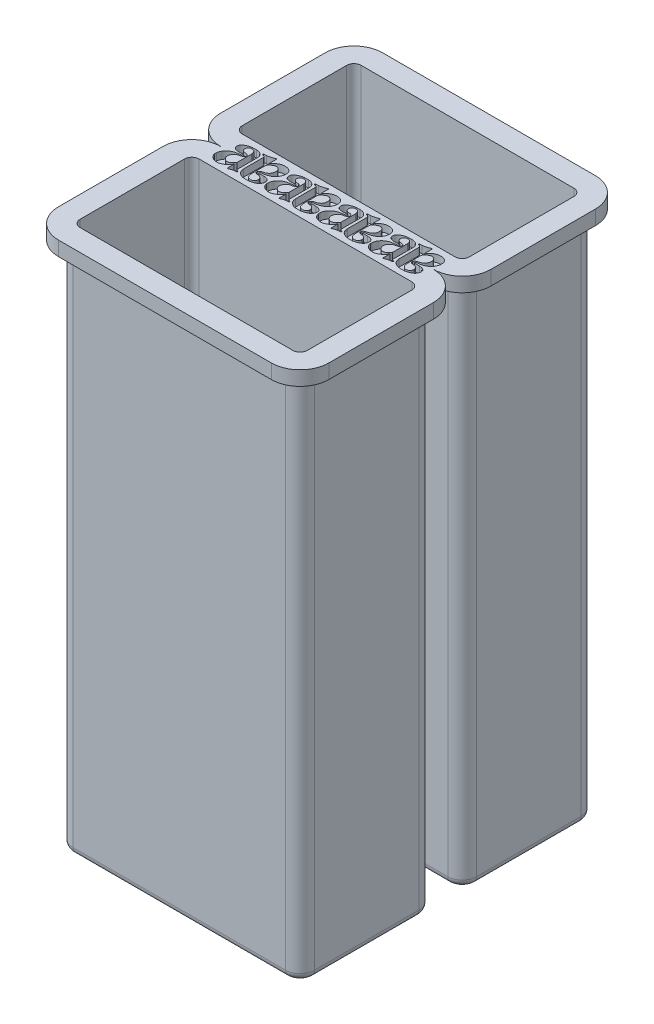
from build123d import *

# Parameters (mm, degrees)
SALIENTE_EXTRUIR1_DEPTH = 74
CROQUIS2_W              = 40
CROQUIS2_H              = 47
CORTAR_EXTRUIR1_DEPTH   = 72
SALIENTE_EXTRUIR2_START = 1
SALIENTE_EXTRUIR2_DEPTH = 1
REDONDEO1_R             = 1
CORTAR_EXTRUIR2_DEPTH   = 1


with BuildPart() as part:
    # Croquis1 → Saliente-Extruir1 (new body)
    with BuildSketch(Plane(origin=(0, 0, 0), x_dir=(1, 0, 0), z_dir=(0, 1, 0))):
        with BuildLine():
            Line((-18.765, 18.5), (-18.765, 4))
            ThreePointArc((-18.765, 4), (-17.593427125, 1.171572875), (-14.765, 0))
            ThreePointArc((-14.765, 0), (-17.593427125, -1.171572875), (-18.765, -4))
            Line((-18.765, -4), (-18.765, -18.5))
            ThreePointArc((-18.765, -18.5), (-17.593427125, -21.328427125), (-14.765, -22.5))
            Line((-14.765, -22.5), (14.765, -22.5))
            ThreePointArc((14.765, -22.5), (17.593427125, -21.328427125), (18.765, -18.5))
            Line((18.765, -18.5), (18.765, -4))
            ThreePointArc((18.765, -4), (17.593427125, -1.171572875), (14.765, 0))
            ThreePointArc((14.765, 0), (17.593427125, 1.171572875), (18.765, 4))
            Line((18.765, 4), (18.765, 18.5))
            ThreePointArc((18.765, 18.5), (17.593427125, 21.328427125), (14.765, 22.5))
            Line((14.765, 22.5), (-14.765, 22.5))
            ThreePointArc((-14.765, 22.5), (-17.593427125, 21.328427125), (-18.765, 18.5))
        make_face()
        with BuildLine():
            Line((-14.765, -3), (14.765, -3))
            ThreePointArc((14.765, -3), (15.472106781, -3.292893219), (15.765, -4))
            Line((15.765, -4), (15.765, -18.5))
            ThreePointArc((15.765, -18.5), (15.472106781, -19.207106781), (14.765, -19.5))
            Line((14.765, -19.5), (-14.765, -19.5))
            ThreePointArc((-14.765, -19.5), (-15.472106781, -19.207106781), (-15.765, -18.5))
            Line((-15.765, -18.5), (-15.765, -4))
            ThreePointArc((-15.765, -4), (-15.472106781, -3.292893219), (-14.765, -3))
        make_face(mode=Mode.SUBTRACT)
        with BuildLine():
            Line((-14.765, 19.5), (14.765, 19.5))
            ThreePointArc((14.765, 19.5), (15.472106781, 19.207106781), (15.765, 18.5))
            Line((15.765, 18.5), (15.765, 4))
            ThreePointArc((15.765, 4), (15.472106781, 3.292893219), (14.765, 3))
            Line((14.765, 3), (-14.765, 3))
            ThreePointArc((-14.765, 3), (-15.472106781, 3.292893219), (-15.765, 4))
            Line((-15.765, 4), (-15.765, 18.5))
            ThreePointArc((-15.765, 18.5), (-15.472106781, 19.207106781), (-14.765, 19.5))
        make_face(mode=Mode.SUBTRACT)
    extrude(amount=-SALIENTE_EXTRUIR1_DEPTH)

    # Croquis2 → Cortar-Extruir1 (cut)
    with BuildSketch(Plane.XZ.offset(74)):
        Rectangle(CROQUIS2_W, CROQUIS2_H)
        with BuildLine():
            Line((-14.765, 2), (14.765, 2))
            ThreePointArc((14.765, 2), (16.179213562, 2.585786438), (16.765, 4))
            Line((16.765, 4), (16.765, 18.5))
            ThreePointArc((16.765, 18.5), (16.179213562, 19.914213562), (14.765, 20.5))
            Line((14.765, 20.5), (-14.765, 20.5))
            ThreePointArc((-14.765, 20.5), (-16.179213562, 19.914213562), (-16.765, 18.5))
            Line((-16.765, 18.5), (-16.765, 4))
            ThreePointArc((-16.765, 4), (-16.179213562, 2.585786438), (-14.765, 2))
        make_face(mode=Mode.SUBTRACT)
        with BuildLine():
            Line((14.765, -20.5), (-14.765, -20.5))
            ThreePointArc((-14.765, -20.5), (-16.179213562, -19.914213562), (-16.765, -18.5))
            Line((-16.765, -18.5), (-16.765, -4))
            ThreePointArc((-16.765, -4), (-16.179213562, -2.585786438), (-14.765, -2))
            Line((-14.765, -2), (14.765, -2))
            ThreePointArc((14.765, -2), (16.179213562, -2.585786438), (16.765, -4))
            Line((16.765, -4), (16.765, -18.5))
            ThreePointArc((16.765, -18.5), (16.179213562, -19.914213562), (14.765, -20.5))
        make_face(mode=Mode.SUBTRACT)
    extrude(amount=-CORTAR_EXTRUIR1_DEPTH, mode=Mode.SUBTRACT)

    # Croquis3 → Saliente-Extruir2 (add)
    with BuildSketch(Plane.XZ.offset(74).offset(SALIENTE_EXTRUIR2_START)):
        with BuildLine():
            Line((-14.765, 2), (14.765, 2))
            ThreePointArc((14.765, 2), (16.179213562, 2.585786438), (16.765, 4))
            Line((16.765, 4), (16.765, 18.5))
            ThreePointArc((16.765, 18.5), (16.179213562, 19.914213562), (14.765, 20.5))
            Line((14.765, 20.5), (-14.765, 20.5))
            ThreePointArc((-14.765, 20.5), (-16.179213562, 19.914213562), (-16.765, 18.5))
            Line((-16.765, 18.5), (-16.765, 4))
            ThreePointArc((-16.765, 4), (-16.179213562, 2.585786438), (-14.765, 2))
        make_face()
        with BuildLine():
            Line((-14.765, -20.5), (14.765, -20.5))
            ThreePointArc((14.765, -20.5), (16.179213562, -19.914213562), (16.765, -18.5))
            Line((16.765, -18.5), (16.765, -4))
            ThreePointArc((16.765, -4), (16.179213562, -2.585786438), (14.765, -2))
            Line((14.765, -2), (-14.765, -2))
            ThreePointArc((-14.765, -2), (-16.179213562, -2.585786438), (-16.765, -4))
            Line((-16.765, -4), (-16.765, -18.5))
            ThreePointArc((-16.765, -18.5), (-16.179213562, -19.914213562), (-14.765, -20.5))
        make_face()
    extrude(amount=-SALIENTE_EXTRUIR2_DEPTH)

    # Redondeo1
    redondeo1_edges = [part.edges().sort_by_distance(p)[0] for p in [
        (-16.179213562, -75, 2.585786438),
        (0, -75, 2),
        (16.179213562, -75, 2.585786438),
        (16.765, -75, 11.25),
        (16.179213562, -75, 19.914213562),
        (0, -75, 20.5),
        (-16.179213562, -75, 19.914213562),
        (-16.765, -75, 11.25),
        (-16.179213562, -75, -19.914213562),
        (0, -75, -20.5),
        (16.179213562, -75, -19.914213562),
        (16.765, -75, -11.25),
        (16.179213562, -75, -2.585786438),
        (0, -75, -2),
        (-16.179213562, -75, -2.585786438),
        (-16.765, -75, -11.25),
        (-15.472106781, -74, -3.292893219),
        (-15.765, -74, -11.25),
        (-15.472106781, -74, -19.207106781),
        (0, -74, -19.5),
        (15.472106781, -74, -19.207106781),
        (15.765, -74, -11.25),
        (15.472106781, -74, -3.292893219),
        (0, -74, -3),
        (-15.472106781, -74, 3.292893219),
        (0, -74, 3),
        (15.472106781, -74, 3.292893219),
        (15.765, -74, 11.25),
        (15.472106781, -74, 19.207106781),
        (0, -74, 19.5),
        (-15.472106781, -74, 19.207106781),
        (-15.765, -74, 11.25),
    ]]
    fillet(redondeo1_edges, radius=REDONDEO1_R)

    # Croquis5 → Cortar-Extruir2 (cut)
    # profile 1 of 8: a face of its own
    with BuildSketch(Plane(origin=(0, 0, 0), x_dir=(1, 0, 0), z_dir=(0, 1, 0))):
        with BuildLine():
            Line((11.12208389, 1.643912915), (11.12208389, -1.094958944))
            add(Edge.make_bspline(
                [(11.12208389, -1.094958944), (11.143103596, -1.367116971), (11.26675666, -1.790244155), (11.78550182, -2.075329476), (12.055663212, -2.188627164), (12.270025204, -2.20343332)],
                knots=[0, 0, 0, 0, 0.49028352, 0.64538248, 1, 1, 1, 1], degree=3))
            Line((12.270025204, -2.20343332), (12.931693569, -2.20343332))
            add(Edge.make_bspline(
                [(12.931693569, -2.20343332), (13.267455898, -2.132026233), (13.860111992, -1.992222085), (14.208009012, -1.470453413), (14.227846028, -1.250333744)],
                knots=[0, 0, 0, 0, 0.615534464, 1, 1, 1, 1], degree=3))
            Line((14.227846028, -1.250333744), (14.227846028, -1.075128784))
            add(Edge.make_bspline(
                [(14.227846028, -1.075128784), (14.215760622, -0.914032073), (14.048303878, -0.708530113), (13.718340934, -0.597297378), (13.520743991, -0.568548486), (13.422918181, -0.568548486)],
                knots=[0, 0, 0, 0, 0.437103845, 0.707413934, 1, 1, 1, 1], degree=3))
            Line((13.422918181, -0.568548486), (12.722501168, -0.568548486))
            add(Edge.make_bspline(
                [(12.722501168, -0.568548486), (12.677219764, -0.554150486), (12.659877431, -0.469737716), (12.72673467, -0.414149832), (12.809206676, -0.376136686), (12.928908015, -0.35756955), (13.743412231, -0.249738336), (14.503894256, 0.06106073), (14.699165118, 1.029991391)],
                knots=[0, 0, 0, 0, 0.049331567, 0.062709189, 0.093395869, 0.148478193, 0.194890473, 1, 1, 1, 1], degree=3))
            Line((14.699165118, 1.029991391), (14.699165118, 1.297045074))
            add(Edge.make_bspline(
                [(14.699165118, 1.297045074), (14.667228995, 1.896154917), (13.974671223, 2.183784884), (12.945133002, 2.00490288), (12.491163648, 1.603623606), (12.253690233, 1.297045074)],
                knots=[0, 0, 0, 0, 0.456887755, 0.617100867, 1, 1, 1, 1], degree=3))
            Line((12.253690233, 1.297045074), (12.253690233, 2.321369871))
            ThreePointArc((12.253690233, 2.321369871), (12.211693307, 2.383353665), (12.136828093, 2.384319181))
            add(Edge.make_bspline(
                [(12.136828093, 2.384319181), (11.656311094, 2.14125638), (11.12208389, 2.090223481)],
                knots=[0, 0, 0, 1, 1, 1], degree=2))
            Line((11.12208389, 2.090223481), (10.743662918, 2.064735118))
            add(Edge.make_bspline(
                [(10.743662918, 2.064735118), (10.691084323, 2.026068737), (10.707332751, 1.92982704), (10.79671894, 1.881008219), (10.894741199, 1.889913825), (11.041965363, 1.832129867), (11.129004731, 1.729214334), (11.12208389, 1.643912915)],
                knots=[0, 0, 0, 0, 0.243545996, 0.329014823, 0.43056247, 0.670310358, 1, 1, 1, 1], degree=3))
        make_face()
        with BuildLine():
            Line((13.440812647, -1.447476629), (13.440812647, -1.361386944))
            add(Edge.make_bspline(
                [(13.440812647, -1.361386944), (13.428435587, -1.232612056), (13.318111823, -0.956493715), (13.038908114, -0.843331196), (12.897247391, -0.828866168)],
                knots=[0, 0, 0, 0, 0.474595012, 1, 1, 1, 1], degree=3))
            Line((12.897247391, -0.828866168), (12.633859698, -0.801971556))
            add(Edge.make_bspline(
                [(12.633859698, -0.801971556), (12.543347909, -0.803095879), (12.442992721, -0.72502402), (12.383855878, -0.607760687), (12.383855878, -0.568548486)],
                knots=[0, 0, 0, 0, 0.677295293, 1, 1, 1, 1], degree=3))
            Line((12.383855878, -0.568548486), (12.383855878, -0.491929702))
            add(Edge.make_bspline(
                [(12.383855878, -0.491929702), (12.424240549, -0.361581816), (12.610074367, -0.186002693), (12.960305701, -0.135556169), (13.246110712, -0.003859871), (13.529723206, 0.197934137), (13.69174869, 0.577243687), (13.706456953, 0.945190105), (13.594842897, 1.209746296), (13.470888479, 1.346678302), (13.326567673, 1.436209483), (13.218647786, 1.456668455), (13.183549965, 1.456668455)],
                knots=[0, 0, 0, 0, 0.139662031, 0.240587309, 0.361900049, 0.46450752, 0.592990267, 0.77477529, 0.82920301, 0.886761562, 0.964190872, 1, 1, 1, 1], degree=3))
            Line((13.183549965, 1.456668455), (13.09195894, 1.456668455))
            add(Edge.make_bspline(
                [(13.09195894, 1.456668455), (12.968933412, 1.456668455), (12.621408692, 1.304940049), (12.350003508, 1.059195498), (12.246380721, 0.8335108)],
                knots=[0, 0, 0, 0, 0.336652232, 1, 1, 1, 1], degree=3))
            Line((12.246380721, 0.8335108), (12.246380721, -1.085921855))
            add(Edge.make_bspline(
                [(12.246380721, -1.085921855), (12.257895123, -1.291480753), (12.311907368, -1.751970024), (13.033071176, -2.054587117), (13.425853132, -1.693891745), (13.440812647, -1.447476629)],
                knots=[0, 0, 0, 0, 0.334105821, 0.635982622, 1, 1, 1, 1], degree=3))
        make_face(mode=Mode.SUBTRACT)
    # profile 2 of 8: a face of its own
    with BuildSketch(Plane(origin=(0, 0, 0), x_dir=(1, 0, 0), z_dir=(0, 1, 0))):
        with BuildLine():
            Line((10.743662918, -1.603485438), (10.743662918, 1.315881708))
            add(Edge.make_bspline(
                [(10.743662918, 1.315881708), (10.743662918, 1.411272589), (10.674162753, 1.593366901), (10.489518185, 1.833638633), (10.237728335, 1.994131484), (9.969487206, 2.070284385), (9.80255614, 2.092020614), (9.720539747, 2.090223481)],
                knots=[0, 0, 0, 0, 0.199723375, 0.404213542, 0.642940483, 0.823735254, 1, 1, 1, 1], degree=3))
            Line((9.720539747, 2.090223481), (9.211659339, 2.079072954))
            add(Edge.make_bspline(
                [(9.211659339, 2.079072954), (8.871703706, 2.045747326), (8.415923943, 1.897197905), (7.866853558, 1.430222064), (7.922776323, 0.939190479), (8.167342512, 0.709957463), (8.282084493, 0.668166078), (8.377744449, 0.655896726)],
                knots=[0, 0, 0, 0, 0.418753771, 0.587264904, 0.852530768, 0.886586146, 1, 1, 1, 1], degree=3))
            add(Edge.make_bspline(
                [(8.377744449, 0.655896726), (8.601833281, 0.608996898), (8.902677601, 0.594928677), (9.239066528, 0.644033194), (9.371376406, 0.651295128), (9.456857568, 0.647229026), (9.501126743, 0.60286417), (9.507827575, 0.54093702), (9.442292491, 0.481794181), (9.330623304, 0.433552855), (9.168560647, 0.407140203), (8.96500607, 0.383602339), (8.741493989, 0.331582466), (8.494071445, 0.2894075), (8.013529857, 0.115787534), (7.483172175, -0.323440276), (7.31385593, -0.867242242), (7.30836678, -1.075128784)],
                knots=[0, 0, 0, 0, 0.164670443, 0.215991005, 0.244354815, 0.261612246, 0.275207239, 0.285848572, 0.302822203, 0.332909342, 0.374903834, 0.420011135, 0.481324638, 0.540460624, 0.600937118, 0.850065081, 1, 1, 1, 1], degree=3))
            Line((7.30836678, -1.075128784), (7.299165118, -1.295892736))
            add(Edge.make_bspline(
                [(7.299165118, -1.295892736), (7.332630694, -1.493232783), (7.526316457, -1.871000112), (8.056916905, -2.124546468), (8.982832462, -2.197839555), (9.632852928, -1.646333936), (9.894799414, -1.18551076)],
                knots=[0, 0, 0, 0, 0.180676094, 0.357502802, 0.502936532, 1, 1, 1, 1], degree=3))
            Line((9.894799414, -1.18551076), (9.894799414, -2.100138227))
            ThreePointArc((9.894799414, -2.100138227), (9.917251527, -2.154342423), (9.971455724, -2.176794537))
            ThreePointArc((9.971455724, -2.176794537), (10.010331723, -2.171059348), (10.04589547, -2.154342423))
            add(Edge.make_bspline(
                [(10.04589547, -2.154342423), (10.196764264, -2.087088256), (10.507723746, -1.942674921), (10.850063116, -1.942658883), (11.015511882, -1.920239014)],
                knots=[0, 0, 0, 0, 0.49789426, 1, 1, 1, 1], degree=3))
            ThreePointArc((11.015511882, -1.920239014), (11.047811324, -1.904255378), (11.063861858, -1.871989127))
            Line((11.063861858, -1.871989127), (11.063861858, -1.815197949))
            ThreePointArc((11.063861858, -1.815197949), (11.049213205, -1.783374475), (11.015511882, -1.773806963))
            add(Edge.make_bspline(
                [(11.015511882, -1.773806963), (10.951499944, -1.773768428), (10.836242326, -1.738176687), (10.766208378, -1.645293694), (10.743662918, -1.603485438)],
                knots=[0, 0, 0, 0, 0.574061575, 1, 1, 1, 1], degree=3))
        make_face()
        with BuildLine():
            Line((9.894799414, -0.771214892), (9.894799414, 1.315881708))
            add(Edge.make_bspline(
                [(9.894799414, 1.315881708), (9.85107007, 1.45785879), (9.790549356, 1.721307641), (9.405057197, 1.934476978), (8.941860894, 1.847627845), (8.749309721, 1.423926851), (8.872620936, 1.060492519), (9.192539027, 0.921289593), (9.462293896, 0.942997448), (9.669206009, 0.862923182), (9.830639939, 0.691013729), (9.78089647, 0.420543303), (9.595373309, 0.32992916), (9.442320402, 0.277504306), (9.241031613, 0.212716427), (9.016287602, 0.187157961), (8.780072001, 0.02925763), (8.492736735, -0.258257038), (8.315453133, -0.942962776), (9.192851436, -1.660586204), (9.752627217, -1.010422622), (9.894799414, -0.771214892)],
                knots=[0, 0, 0, 0, 0.066892963, 0.099946621, 0.178793471, 0.231586427, 0.27714866, 0.325592682, 0.36601227, 0.390454899, 0.416998256, 0.460092448, 0.480657107, 0.501537674, 0.528892465, 0.569983398, 0.594816366, 0.647097793, 0.741154623, 0.856429425, 1, 1, 1, 1], degree=3))
        make_face(mode=Mode.SUBTRACT)
    # profile 3 of 8: a face of its own
    with BuildSketch(Plane(origin=(0, 0, 0), x_dir=(1, 0, 0), z_dir=(0, 1, 0))):
        with BuildLine():
            Line((3.92208389, 1.643912915), (3.92208389, -1.094958944))
            add(Edge.make_bspline(
                [(3.92208389, -1.094958944), (3.943103596, -1.367116971), (4.06675666, -1.790244155), (4.58550182, -2.075329476), (4.855663212, -2.188627164), (5.070025204, -2.20343332)],
                knots=[0, 0, 0, 0, 0.49028352, 0.64538248, 1, 1, 1, 1], degree=3))
            Line((5.070025204, -2.20343332), (5.731693569, -2.20343332))
            add(Edge.make_bspline(
                [(5.731693569, -2.20343332), (6.067455898, -2.132026233), (6.660111992, -1.992222085), (7.008009012, -1.470453413), (7.027846028, -1.250333744)],
                knots=[0, 0, 0, 0, 0.615534464, 1, 1, 1, 1], degree=3))
            Line((7.027846028, -1.250333744), (7.027846028, -1.075128784))
            add(Edge.make_bspline(
                [(7.027846028, -1.075128784), (7.015760622, -0.914032073), (6.848303878, -0.708530113), (6.518340934, -0.597297378), (6.320743991, -0.568548486), (6.222918181, -0.568548486)],
                knots=[0, 0, 0, 0, 0.437103845, 0.707413934, 1, 1, 1, 1], degree=3))
            Line((6.222918181, -0.568548486), (5.522501168, -0.568548486))
            add(Edge.make_bspline(
                [(5.522501168, -0.568548486), (5.477219764, -0.554150486), (5.459877431, -0.469737716), (5.52673467, -0.414149832), (5.609206676, -0.376136686), (5.728908015, -0.35756955), (6.543412231, -0.249738336), (7.303894256, 0.06106073), (7.499165118, 1.029991391)],
                knots=[0, 0, 0, 0, 0.049331567, 0.062709189, 0.093395869, 0.148478193, 0.194890473, 1, 1, 1, 1], degree=3))
            Line((7.499165118, 1.029991391), (7.499165118, 1.297045074))
            add(Edge.make_bspline(
                [(7.499165118, 1.297045074), (7.467228995, 1.896154917), (6.774671223, 2.183784884), (5.745133002, 2.00490288), (5.291163648, 1.603623606), (5.053690233, 1.297045074)],
                knots=[0, 0, 0, 0, 0.456887755, 0.617100867, 1, 1, 1, 1], degree=3))
            Line((5.053690233, 1.297045074), (5.053690233, 2.321369871))
            ThreePointArc((5.053690233, 2.321369871), (5.011693307, 2.383353665), (4.936828093, 2.384319181))
            add(Edge.make_bspline(
                [(4.936828093, 2.384319181), (4.456311094, 2.14125638), (3.92208389, 2.090223481)],
                knots=[0, 0, 0, 1, 1, 1], degree=2))
            Line((3.92208389, 2.090223481), (3.543662918, 2.064735118))
            add(Edge.make_bspline(
                [(3.543662918, 2.064735118), (3.491084323, 2.026068737), (3.507332751, 1.92982704), (3.59671894, 1.881008219), (3.694741199, 1.889913825), (3.841965363, 1.832129867), (3.929004731, 1.729214334), (3.92208389, 1.643912915)],
                knots=[0, 0, 0, 0, 0.243545996, 0.329014823, 0.43056247, 0.670310358, 1, 1, 1, 1], degree=3))
        make_face()
        with BuildLine():
            Line((6.240812647, -1.447476629), (6.240812647, -1.361386944))
            add(Edge.make_bspline(
                [(6.240812647, -1.361386944), (6.228435587, -1.232612056), (6.118111823, -0.956493715), (5.838908114, -0.843331196), (5.697247391, -0.828866168)],
                knots=[0, 0, 0, 0, 0.474595012, 1, 1, 1, 1], degree=3))
            Line((5.697247391, -0.828866168), (5.433859698, -0.801971556))
            add(Edge.make_bspline(
                [(5.433859698, -0.801971556), (5.343347909, -0.803095879), (5.242992721, -0.72502402), (5.183855878, -0.607760687), (5.183855878, -0.568548486)],
                knots=[0, 0, 0, 0, 0.677295293, 1, 1, 1, 1], degree=3))
            Line((5.183855878, -0.568548486), (5.183855878, -0.491929702))
            add(Edge.make_bspline(
                [(5.183855878, -0.491929702), (5.224240549, -0.361581816), (5.410074367, -0.186002693), (5.760305701, -0.135556169), (6.046110712, -0.003859871), (6.329723206, 0.197934137), (6.49174869, 0.577243687), (6.506456953, 0.945190105), (6.394842897, 1.209746296), (6.270888479, 1.346678302), (6.126567673, 1.436209483), (6.018647786, 1.456668455), (5.983549965, 1.456668455)],
                knots=[0, 0, 0, 0, 0.139662031, 0.240587309, 0.361900049, 0.46450752, 0.592990267, 0.77477529, 0.82920301, 0.886761562, 0.964190872, 1, 1, 1, 1], degree=3))
            Line((5.983549965, 1.456668455), (5.89195894, 1.456668455))
            add(Edge.make_bspline(
                [(5.89195894, 1.456668455), (5.768933412, 1.456668455), (5.421408692, 1.304940049), (5.150003508, 1.059195498), (5.046380721, 0.8335108)],
                knots=[0, 0, 0, 0, 0.336652232, 1, 1, 1, 1], degree=3))
            Line((5.046380721, 0.8335108), (5.046380721, -1.085921855))
            add(Edge.make_bspline(
                [(5.046380721, -1.085921855), (5.057895123, -1.291480753), (5.111907368, -1.751970024), (5.833071176, -2.054587117), (6.225853132, -1.693891745), (6.240812647, -1.447476629)],
                knots=[0, 0, 0, 0, 0.334105821, 0.635982622, 1, 1, 1, 1], degree=3))
        make_face(mode=Mode.SUBTRACT)
    # profile 4 of 8: a face of its own
    with BuildSketch(Plane(origin=(0, 0, 0), x_dir=(1, 0, 0), z_dir=(0, 1, 0))):
        with BuildLine():
            Line((3.543662918, -1.603485438), (3.543662918, 1.315881708))
            add(Edge.make_bspline(
                [(3.543662918, 1.315881708), (3.543662918, 1.411272589), (3.474162753, 1.593366901), (3.289518185, 1.833638633), (3.037728335, 1.994131484), (2.769487206, 2.070284385), (2.60255614, 2.092020614), (2.520539747, 2.090223481)],
                knots=[0, 0, 0, 0, 0.199723375, 0.404213542, 0.642940483, 0.823735254, 1, 1, 1, 1], degree=3))
            Line((2.520539747, 2.090223481), (2.011659339, 2.079072954))
            add(Edge.make_bspline(
                [(2.011659339, 2.079072954), (1.671703706, 2.045747326), (1.215923943, 1.897197905), (0.666853558, 1.430222064), (0.722776323, 0.939190479), (0.967342512, 0.709957463), (1.082084493, 0.668166078), (1.177744449, 0.655896726)],
                knots=[0, 0, 0, 0, 0.418753771, 0.587264904, 0.852530768, 0.886586146, 1, 1, 1, 1], degree=3))
            add(Edge.make_bspline(
                [(1.177744449, 0.655896726), (1.401833281, 0.608996898), (1.702677601, 0.594928677), (2.039066528, 0.644033194), (2.171376406, 0.651295128), (2.256857568, 0.647229026), (2.301126743, 0.60286417), (2.307827575, 0.54093702), (2.242292491, 0.481794181), (2.130623304, 0.433552855), (1.968560647, 0.407140203), (1.76500607, 0.383602339), (1.541493989, 0.331582466), (1.294071445, 0.2894075), (0.813529857, 0.115787534), (0.283172175, -0.323440276), (0.11385593, -0.867242242), (0.10836678, -1.075128784)],
                knots=[0, 0, 0, 0, 0.164670443, 0.215991005, 0.244354815, 0.261612246, 0.275207239, 0.285848572, 0.302822203, 0.332909342, 0.374903834, 0.420011135, 0.481324638, 0.540460624, 0.600937118, 0.850065081, 1, 1, 1, 1], degree=3))
            Line((0.10836678, -1.075128784), (0.099165118, -1.295892736))
            add(Edge.make_bspline(
                [(0.099165118, -1.295892736), (0.132630694, -1.493232783), (0.326316457, -1.871000112), (0.856916905, -2.124546468), (1.782832462, -2.197839555), (2.432852928, -1.646333936), (2.694799414, -1.18551076)],
                knots=[0, 0, 0, 0, 0.180676094, 0.357502802, 0.502936532, 1, 1, 1, 1], degree=3))
            Line((2.694799414, -1.18551076), (2.694799414, -2.100138227))
            ThreePointArc((2.694799414, -2.100138227), (2.717251527, -2.154342423), (2.771455724, -2.176794537))
            ThreePointArc((2.771455724, -2.176794537), (2.810331723, -2.171059348), (2.84589547, -2.154342423))
            add(Edge.make_bspline(
                [(2.84589547, -2.154342423), (2.996764264, -2.087088256), (3.307723746, -1.942674921), (3.650063116, -1.942658883), (3.815511882, -1.920239014)],
                knots=[0, 0, 0, 0, 0.49789426, 1, 1, 1, 1], degree=3))
            ThreePointArc((3.815511882, -1.920239014), (3.847811324, -1.904255378), (3.863861858, -1.871989127))
            Line((3.863861858, -1.871989127), (3.863861858, -1.815197949))
            ThreePointArc((3.863861858, -1.815197949), (3.849213205, -1.783374475), (3.815511882, -1.773806963))
            add(Edge.make_bspline(
                [(3.815511882, -1.773806963), (3.751499944, -1.773768428), (3.636242326, -1.738176687), (3.566208378, -1.645293694), (3.543662918, -1.603485438)],
                knots=[0, 0, 0, 0, 0.574061575, 1, 1, 1, 1], degree=3))
        make_face()
        with BuildLine():
            Line((2.694799414, -0.771214892), (2.694799414, 1.315881708))
            add(Edge.make_bspline(
                [(2.694799414, 1.315881708), (2.65107007, 1.45785879), (2.590549356, 1.721307641), (2.205057197, 1.934476978), (1.741860894, 1.847627845), (1.549309721, 1.423926851), (1.672620936, 1.060492519), (1.992539027, 0.921289593), (2.262293896, 0.942997448), (2.469206009, 0.862923182), (2.630639939, 0.691013729), (2.58089647, 0.420543303), (2.395373309, 0.32992916), (2.242320402, 0.277504306), (2.041031613, 0.212716427), (1.816287602, 0.187157961), (1.580072001, 0.02925763), (1.292736735, -0.258257038), (1.115453133, -0.942962776), (1.992851436, -1.660586204), (2.552627217, -1.010422622), (2.694799414, -0.771214892)],
                knots=[0, 0, 0, 0, 0.066892963, 0.099946621, 0.178793471, 0.231586427, 0.27714866, 0.325592682, 0.36601227, 0.390454899, 0.416998256, 0.460092448, 0.480657107, 0.501537674, 0.528892465, 0.569983398, 0.594816366, 0.647097793, 0.741154623, 0.856429425, 1, 1, 1, 1], degree=3))
        make_face(mode=Mode.SUBTRACT)
    # profile 5 of 8: a face of its own
    with BuildSketch(Plane(origin=(0, 0, 0), x_dir=(1, 0, 0), z_dir=(0, 1, 0))):
        with BuildLine():
            Line((-3.27791611, 1.643912915), (-3.27791611, -1.094958944))
            add(Edge.make_bspline(
                [(-3.27791611, -1.094958944), (-3.256896404, -1.367116971), (-3.13324334, -1.790244155), (-2.61449818, -2.075329476), (-2.344336788, -2.188627164), (-2.129974796, -2.20343332)],
                knots=[0, 0, 0, 0, 0.49028352, 0.64538248, 1, 1, 1, 1], degree=3))
            Line((-2.129974796, -2.20343332), (-1.468306431, -2.20343332))
            add(Edge.make_bspline(
                [(-1.468306431, -2.20343332), (-1.132544102, -2.132026233), (-0.539888008, -1.992222085), (-0.191990988, -1.470453413), (-0.172153972, -1.250333744)],
                knots=[0, 0, 0, 0, 0.615534464, 1, 1, 1, 1], degree=3))
            Line((-0.172153972, -1.250333744), (-0.172153972, -1.075128784))
            add(Edge.make_bspline(
                [(-0.172153972, -1.075128784), (-0.184239378, -0.914032073), (-0.351696122, -0.708530113), (-0.681659066, -0.597297378), (-0.879256009, -0.568548486), (-0.977081819, -0.568548486)],
                knots=[0, 0, 0, 0, 0.437103845, 0.707413934, 1, 1, 1, 1], degree=3))
            Line((-0.977081819, -0.568548486), (-1.677498832, -0.568548486))
            add(Edge.make_bspline(
                [(-1.677498832, -0.568548486), (-1.722780236, -0.554150486), (-1.740122569, -0.469737716), (-1.67326533, -0.414149832), (-1.590793324, -0.376136686), (-1.471091985, -0.35756955), (-0.656587769, -0.249738336), (0.103894256, 0.06106073), (0.299165118, 1.029991391)],
                knots=[0, 0, 0, 0, 0.049331567, 0.062709189, 0.093395869, 0.148478193, 0.194890473, 1, 1, 1, 1], degree=3))
            Line((0.299165118, 1.029991391), (0.299165118, 1.297045074))
            add(Edge.make_bspline(
                [(0.299165118, 1.297045074), (0.267228995, 1.896154917), (-0.425328777, 2.183784884), (-1.454866998, 2.00490288), (-1.908836352, 1.603623606), (-2.146309767, 1.297045074)],
                knots=[0, 0, 0, 0, 0.456887755, 0.617100867, 1, 1, 1, 1], degree=3))
            Line((-2.146309767, 1.297045074), (-2.146309767, 2.321369871))
            ThreePointArc((-2.146309767, 2.321369871), (-2.188306693, 2.383353665), (-2.263171907, 2.384319181))
            add(Edge.make_bspline(
                [(-2.263171907, 2.384319181), (-2.743688906, 2.14125638), (-3.27791611, 2.090223481)],
                knots=[0, 0, 0, 1, 1, 1], degree=2))
            Line((-3.27791611, 2.090223481), (-3.656337082, 2.064735118))
            add(Edge.make_bspline(
                [(-3.656337082, 2.064735118), (-3.708915677, 2.026068737), (-3.692667249, 1.92982704), (-3.60328106, 1.881008219), (-3.505258801, 1.889913825), (-3.358034637, 1.832129867), (-3.270995269, 1.729214334), (-3.27791611, 1.643912915)],
                knots=[0, 0, 0, 0, 0.243545996, 0.329014823, 0.43056247, 0.670310358, 1, 1, 1, 1], degree=3))
        make_face()
        with BuildLine():
            Line((-2.016144122, -0.568548486), (-2.016144122, -0.491929702))
            add(Edge.make_bspline(
                [(-2.016144122, -0.491929702), (-1.975759451, -0.361581816), (-1.789925633, -0.186002693), (-1.439694299, -0.135556169), (-1.153889288, -0.003859871), (-0.870276794, 0.197934137), (-0.70825131, 0.577243687), (-0.693543047, 0.945190105), (-0.805157103, 1.209746296), (-0.929111521, 1.346678302), (-1.073432327, 1.436209483), (-1.181352214, 1.456668455), (-1.216450035, 1.456668455)],
                knots=[0, 0, 0, 0, 0.139662031, 0.240587309, 0.361900049, 0.46450752, 0.592990267, 0.77477529, 0.82920301, 0.886761562, 0.964190872, 1, 1, 1, 1], degree=3))
            Line((-1.216450035, 1.456668455), (-1.30804106, 1.456668455))
            add(Edge.make_bspline(
                [(-1.30804106, 1.456668455), (-1.431066588, 1.456668455), (-1.778591308, 1.304940049), (-2.049996492, 1.059195498), (-2.153619279, 0.8335108)],
                knots=[0, 0, 0, 0, 0.336652232, 1, 1, 1, 1], degree=3))
            Line((-2.153619279, 0.8335108), (-2.153619279, -1.085921855))
            add(Edge.make_bspline(
                [(-2.153619279, -1.085921855), (-2.142104877, -1.291480753), (-2.088092632, -1.751970024), (-1.366928824, -2.054587117), (-0.974146868, -1.693891745), (-0.959187353, -1.447476629)],
                knots=[0, 0, 0, 0, 0.334105821, 0.635982622, 1, 1, 1, 1], degree=3))
            Line((-0.959187353, -1.447476629), (-0.959187353, -1.361386944))
            add(Edge.make_bspline(
                [(-0.959187353, -1.361386944), (-0.971564413, -1.232612056), (-1.081888177, -0.956493715), (-1.361091886, -0.843331196), (-1.502752609, -0.828866168)],
                knots=[0, 0, 0, 0, 0.474595012, 1, 1, 1, 1], degree=3))
            Line((-1.502752609, -0.828866168), (-1.766140302, -0.801971556))
            add(Edge.make_bspline(
                [(-1.766140302, -0.801971556), (-1.856652091, -0.803095879), (-1.957007279, -0.72502402), (-2.016144122, -0.607760687), (-2.016144122, -0.568548486)],
                knots=[0, 0, 0, 0, 0.677295293, 1, 1, 1, 1], degree=3))
        make_face(mode=Mode.SUBTRACT)
    # profile 6 of 8: a face of its own
    with BuildSketch(Plane(origin=(0, 0, 0), x_dir=(1, 0, 0), z_dir=(0, 1, 0))):
        with BuildLine():
            Line((-3.656337082, -1.603485438), (-3.656337082, 1.315881708))
            add(Edge.make_bspline(
                [(-3.656337082, 1.315881708), (-3.656337082, 1.411272589), (-3.725837247, 1.593366901), (-3.910481815, 1.833638633), (-4.162271665, 1.994131484), (-4.430512794, 2.070284385), (-4.59744386, 2.092020614), (-4.679460253, 2.090223481)],
                knots=[0, 0, 0, 0, 0.199723375, 0.404213542, 0.642940483, 0.823735254, 1, 1, 1, 1], degree=3))
            Line((-4.679460253, 2.090223481), (-5.188340661, 2.079072954))
            add(Edge.make_bspline(
                [(-5.188340661, 2.079072954), (-5.528296294, 2.045747326), (-5.984076057, 1.897197905), (-6.533146442, 1.430222064), (-6.477223677, 0.939190479), (-6.232657488, 0.709957463), (-6.117915507, 0.668166078), (-6.022255551, 0.655896726)],
                knots=[0, 0, 0, 0, 0.418753771, 0.587264904, 0.852530768, 0.886586146, 1, 1, 1, 1], degree=3))
            add(Edge.make_bspline(
                [(-6.022255551, 0.655896726), (-5.798166719, 0.608996898), (-5.497322399, 0.594928677), (-5.160933472, 0.644033194), (-5.028623594, 0.651295128), (-4.943142432, 0.647229026), (-4.898873257, 0.60286417), (-4.892172425, 0.54093702), (-4.957707509, 0.481794181), (-5.069376696, 0.433552855), (-5.231439353, 0.407140203), (-5.43499393, 0.383602339), (-5.658506011, 0.331582466), (-5.905928555, 0.2894075), (-6.386470143, 0.115787534), (-6.916827825, -0.323440276), (-7.08614407, -0.867242242), (-7.09163322, -1.075128784)],
                knots=[0, 0, 0, 0, 0.164670443, 0.215991005, 0.244354815, 0.261612246, 0.275207239, 0.285848572, 0.302822203, 0.332909342, 0.374903834, 0.420011135, 0.481324638, 0.540460624, 0.600937118, 0.850065081, 1, 1, 1, 1], degree=3))
            Line((-7.09163322, -1.075128784), (-7.100834882, -1.295892736))
            add(Edge.make_bspline(
                [(-7.100834882, -1.295892736), (-7.067369306, -1.493232783), (-6.873683543, -1.871000112), (-6.343083095, -2.124546468), (-5.417167538, -2.197839555), (-4.767147072, -1.646333936), (-4.505200586, -1.18551076)],
                knots=[0, 0, 0, 0, 0.180676094, 0.357502802, 0.502936532, 1, 1, 1, 1], degree=3))
            Line((-4.505200586, -1.18551076), (-4.505200586, -2.100138227))
            ThreePointArc((-4.505200586, -2.100138227), (-4.482748473, -2.154342423), (-4.428544276, -2.176794537))
            ThreePointArc((-4.428544276, -2.176794537), (-4.389668277, -2.171059348), (-4.35410453, -2.154342423))
            add(Edge.make_bspline(
                [(-4.35410453, -2.154342423), (-4.203235736, -2.087088256), (-3.892276254, -1.942674921), (-3.549936884, -1.942658883), (-3.384488118, -1.920239014)],
                knots=[0, 0, 0, 0, 0.49789426, 1, 1, 1, 1], degree=3))
            ThreePointArc((-3.384488118, -1.920239014), (-3.352188676, -1.904255378), (-3.336138142, -1.871989127))
            Line((-3.336138142, -1.871989127), (-3.336138142, -1.815197949))
            ThreePointArc((-3.336138142, -1.815197949), (-3.350786795, -1.783374475), (-3.384488118, -1.773806963))
            add(Edge.make_bspline(
                [(-3.384488118, -1.773806963), (-3.448500056, -1.773768428), (-3.563757674, -1.738176687), (-3.633791622, -1.645293694), (-3.656337082, -1.603485438)],
                knots=[0, 0, 0, 0, 0.574061575, 1, 1, 1, 1], degree=3))
        make_face()
        with BuildLine():
            Line((-4.505200586, -0.771214892), (-4.505200586, 1.315881708))
            add(Edge.make_bspline(
                [(-4.505200586, 1.315881708), (-4.54892993, 1.45785879), (-4.609450644, 1.721307641), (-4.994942803, 1.934476978), (-5.458139106, 1.847627845), (-5.650690279, 1.423926851), (-5.527379064, 1.060492519), (-5.207460973, 0.921289593), (-4.937706104, 0.942997448), (-4.730793991, 0.862923182), (-4.569360061, 0.691013729), (-4.61910353, 0.420543303), (-4.804626691, 0.32992916), (-4.957679598, 0.277504306), (-5.158968387, 0.212716427), (-5.383712398, 0.187157961), (-5.619927999, 0.02925763), (-5.907263265, -0.258257038), (-6.084546867, -0.942962776), (-5.207148564, -1.660586204), (-4.647372783, -1.010422622), (-4.505200586, -0.771214892)],
                knots=[0, 0, 0, 0, 0.066892963, 0.099946621, 0.178793471, 0.231586427, 0.27714866, 0.325592682, 0.36601227, 0.390454899, 0.416998256, 0.460092448, 0.480657107, 0.501537674, 0.528892465, 0.569983398, 0.594816366, 0.647097793, 0.741154623, 0.856429425, 1, 1, 1, 1], degree=3))
        make_face(mode=Mode.SUBTRACT)
    # profile 7 of 8: a face of its own
    with BuildSketch(Plane(origin=(0, 0, 0), x_dir=(1, 0, 0), z_dir=(0, 1, 0))):
        with BuildLine():
            Line((-10.47791611, 1.643912915), (-10.47791611, -1.094958944))
            add(Edge.make_bspline(
                [(-10.47791611, -1.094958944), (-10.456896404, -1.367116971), (-10.33324334, -1.790244155), (-9.81449818, -2.075329476), (-9.544336788, -2.188627164), (-9.329974796, -2.20343332)],
                knots=[0, 0, 0, 0, 0.49028352, 0.64538248, 1, 1, 1, 1], degree=3))
            Line((-9.329974796, -2.20343332), (-8.668306431, -2.20343332))
            add(Edge.make_bspline(
                [(-8.668306431, -2.20343332), (-8.332544102, -2.132026233), (-7.739888008, -1.992222085), (-7.391990988, -1.470453413), (-7.372153972, -1.250333744)],
                knots=[0, 0, 0, 0, 0.615534464, 1, 1, 1, 1], degree=3))
            Line((-7.372153972, -1.250333744), (-7.372153972, -1.075128784))
            add(Edge.make_bspline(
                [(-7.372153972, -1.075128784), (-7.384239378, -0.914032073), (-7.551696122, -0.708530113), (-7.881659066, -0.597297378), (-8.079256009, -0.568548486), (-8.177081819, -0.568548486)],
                knots=[0, 0, 0, 0, 0.437103845, 0.707413934, 1, 1, 1, 1], degree=3))
            Line((-8.177081819, -0.568548486), (-8.877498832, -0.568548486))
            add(Edge.make_bspline(
                [(-8.877498832, -0.568548486), (-8.922780236, -0.554150486), (-8.940122569, -0.469737716), (-8.87326533, -0.414149832), (-8.790793324, -0.376136686), (-8.671091985, -0.35756955), (-7.856587769, -0.249738336), (-7.096105744, 0.06106073), (-6.900834882, 1.029991391)],
                knots=[0, 0, 0, 0, 0.049331567, 0.062709189, 0.093395869, 0.148478193, 0.194890473, 1, 1, 1, 1], degree=3))
            Line((-6.900834882, 1.029991391), (-6.900834882, 1.297045074))
            add(Edge.make_bspline(
                [(-6.900834882, 1.297045074), (-6.932771005, 1.896154917), (-7.625328777, 2.183784884), (-8.654866998, 2.00490288), (-9.108836352, 1.603623606), (-9.346309767, 1.297045074)],
                knots=[0, 0, 0, 0, 0.456887755, 0.617100867, 1, 1, 1, 1], degree=3))
            Line((-9.346309767, 1.297045074), (-9.346309767, 2.321369871))
            ThreePointArc((-9.346309767, 2.321369871), (-9.388306693, 2.383353665), (-9.463171907, 2.384319181))
            add(Edge.make_bspline(
                [(-9.463171907, 2.384319181), (-9.943688906, 2.14125638), (-10.47791611, 2.090223481)],
                knots=[0, 0, 0, 1, 1, 1], degree=2))
            Line((-10.47791611, 2.090223481), (-10.856337082, 2.064735118))
            add(Edge.make_bspline(
                [(-10.856337082, 2.064735118), (-10.908915677, 2.026068737), (-10.892667249, 1.92982704), (-10.80328106, 1.881008219), (-10.705258801, 1.889913825), (-10.558034637, 1.832129867), (-10.470995269, 1.729214334), (-10.47791611, 1.643912915)],
                knots=[0, 0, 0, 0, 0.243545996, 0.329014823, 0.43056247, 0.670310358, 1, 1, 1, 1], degree=3))
        make_face()
        with BuildLine():
            Line((-8.159187353, -1.447476629), (-8.159187353, -1.361386944))
            add(Edge.make_bspline(
                [(-8.159187353, -1.361386944), (-8.171564413, -1.232612056), (-8.281888177, -0.956493715), (-8.561091886, -0.843331196), (-8.702752609, -0.828866168)],
                knots=[0, 0, 0, 0, 0.474595012, 1, 1, 1, 1], degree=3))
            Line((-8.702752609, -0.828866168), (-8.966140302, -0.801971556))
            add(Edge.make_bspline(
                [(-8.966140302, -0.801971556), (-9.056652091, -0.803095879), (-9.157007279, -0.72502402), (-9.216144122, -0.607760687), (-9.216144122, -0.568548486)],
                knots=[0, 0, 0, 0, 0.677295293, 1, 1, 1, 1], degree=3))
            Line((-9.216144122, -0.568548486), (-9.216144122, -0.491929702))
            add(Edge.make_bspline(
                [(-9.216144122, -0.491929702), (-9.175759451, -0.361581816), (-8.989925633, -0.186002693), (-8.639694299, -0.135556169), (-8.353889288, -0.003859871), (-8.070276794, 0.197934137), (-7.90825131, 0.577243687), (-7.893543047, 0.945190105), (-8.005157103, 1.209746296), (-8.129111521, 1.346678302), (-8.273432327, 1.436209483), (-8.381352214, 1.456668455), (-8.416450035, 1.456668455)],
                knots=[0, 0, 0, 0, 0.139662031, 0.240587309, 0.361900049, 0.46450752, 0.592990267, 0.77477529, 0.82920301, 0.886761562, 0.964190872, 1, 1, 1, 1], degree=3))
            Line((-8.416450035, 1.456668455), (-8.50804106, 1.456668455))
            add(Edge.make_bspline(
                [(-8.50804106, 1.456668455), (-8.631066588, 1.456668455), (-8.978591308, 1.304940049), (-9.249996492, 1.059195498), (-9.353619279, 0.8335108)],
                knots=[0, 0, 0, 0, 0.336652232, 1, 1, 1, 1], degree=3))
            Line((-9.353619279, 0.8335108), (-9.353619279, -1.085921855))
            add(Edge.make_bspline(
                [(-9.353619279, -1.085921855), (-9.342104877, -1.291480753), (-9.288092632, -1.751970024), (-8.566928824, -2.054587117), (-8.174146868, -1.693891745), (-8.159187353, -1.447476629)],
                knots=[0, 0, 0, 0, 0.334105821, 0.635982622, 1, 1, 1, 1], degree=3))
        make_face(mode=Mode.SUBTRACT)
    # profile 8 of 8: a face of its own
    with BuildSketch(Plane(origin=(0, 0, 0), x_dir=(1, 0, 0), z_dir=(0, 1, 0))):
        with BuildLine():
            Line((-10.856337082, -1.603485438), (-10.856337082, 1.315881708))
            add(Edge.make_bspline(
                [(-10.856337082, 1.315881708), (-10.856337082, 1.411272589), (-10.925837247, 1.593366901), (-11.110481815, 1.833638633), (-11.362271665, 1.994131484), (-11.630512794, 2.070284385), (-11.79744386, 2.092020614), (-11.879460253, 2.090223481)],
                knots=[0, 0, 0, 0, 0.199723375, 0.404213542, 0.642940483, 0.823735254, 1, 1, 1, 1], degree=3))
            Line((-11.879460253, 2.090223481), (-12.388340661, 2.079072954))
            add(Edge.make_bspline(
                [(-12.388340661, 2.079072954), (-12.728296294, 2.045747326), (-13.184076057, 1.897197905), (-13.733146442, 1.430222064), (-13.677223677, 0.939190479), (-13.432657488, 0.709957463), (-13.317915507, 0.668166078), (-13.222255551, 0.655896726)],
                knots=[0, 0, 0, 0, 0.418753771, 0.587264904, 0.852530768, 0.886586146, 1, 1, 1, 1], degree=3))
            add(Edge.make_bspline(
                [(-13.222255551, 0.655896726), (-12.998166719, 0.608996898), (-12.697322399, 0.594928677), (-12.360933472, 0.644033194), (-12.228623594, 0.651295128), (-12.143142432, 0.647229026), (-12.098873257, 0.60286417), (-12.092172425, 0.540937019), (-12.157707511, 0.481794181), (-12.269376678, 0.433552855), (-12.431439454, 0.407140207), (-12.634993466, 0.383602323), (-12.858508399, 0.331582547), (-13.10592, 0.289407209), (-13.58654616, 0.115790121), (-14.068419221, -0.284201508), (-14.269803296, -0.811213849), (-14.289259898, -1.018188664), (-14.29163322, -1.075128784)],
                knots=[0, 0, 0, 0, 0.164670443, 0.215991005, 0.244354815, 0.261612246, 0.275207239, 0.285848572, 0.302822203, 0.332909342, 0.374903834, 0.420011135, 0.481324638, 0.540460624, 0.600937118, 0.850065081, 0.958911491, 1, 1, 1, 1], degree=3))
            Line((-14.29163322, -1.075128784), (-14.300834882, -1.295892736))
            add(Edge.make_bspline(
                [(-14.300834882, -1.295892736), (-14.267369306, -1.493232783), (-14.073683543, -1.871000112), (-13.543083095, -2.124546468), (-12.617167538, -2.197839555), (-11.967147072, -1.646333936), (-11.705200586, -1.18551076)],
                knots=[0, 0, 0, 0, 0.180676094, 0.357502802, 0.502936532, 1, 1, 1, 1], degree=3))
            Line((-11.705200586, -1.18551076), (-11.705200586, -2.100138227))
            ThreePointArc((-11.705200586, -2.100138227), (-11.682748473, -2.154342423), (-11.628544276, -2.176794537))
            ThreePointArc((-11.628544276, -2.176794537), (-11.589668277, -2.171059348), (-11.55410453, -2.154342423))
            add(Edge.make_bspline(
                [(-11.55410453, -2.154342423), (-11.403235736, -2.087088256), (-11.092276254, -1.942674921), (-10.749936884, -1.942658883), (-10.584488118, -1.920239014)],
                knots=[0, 0, 0, 0, 0.49789426, 1, 1, 1, 1], degree=3))
            ThreePointArc((-10.584488118, -1.920239014), (-10.552188676, -1.904255378), (-10.536138142, -1.871989127))
            Line((-10.536138142, -1.871989127), (-10.536138142, -1.815197949))
            ThreePointArc((-10.536138142, -1.815197949), (-10.550786795, -1.783374475), (-10.584488118, -1.773806963))
            add(Edge.make_bspline(
                [(-10.584488118, -1.773806963), (-10.648500056, -1.773768428), (-10.763757674, -1.738176687), (-10.833791622, -1.645293694), (-10.856337082, -1.603485438)],
                knots=[0, 0, 0, 0, 0.574061575, 1, 1, 1, 1], degree=3))
        make_face()
        with BuildLine():
            Line((-11.705200586, -0.771214892), (-11.705200586, 1.315881708))
            add(Edge.make_bspline(
                [(-11.705200586, 1.315881708), (-11.74892993, 1.45785879), (-11.809450644, 1.721307641), (-12.194942803, 1.934476978), (-12.658139106, 1.847627845), (-12.850690279, 1.423926851), (-12.727379064, 1.060492519), (-12.407460973, 0.921289593), (-12.137706104, 0.942997448), (-11.930793991, 0.862923182), (-11.769360061, 0.691013729), (-11.81910353, 0.420543303), (-12.004626691, 0.32992916), (-12.157679598, 0.277504306), (-12.358968387, 0.212716427), (-12.583712398, 0.187157961), (-12.819927999, 0.02925763), (-13.107263265, -0.258257038), (-13.284546867, -0.942962776), (-12.407148564, -1.660586204), (-11.847372783, -1.010422622), (-11.705200586, -0.771214892)],
                knots=[0, 0, 0, 0, 0.066892963, 0.099946621, 0.178793471, 0.231586427, 0.27714866, 0.325592682, 0.36601227, 0.390454899, 0.416998256, 0.460092448, 0.480657107, 0.501537674, 0.528892465, 0.569983398, 0.594816366, 0.647097793, 0.741154623, 0.856429425, 1, 1, 1, 1], degree=3))
        make_face(mode=Mode.SUBTRACT)
    extrude(amount=-CORTAR_EXTRUIR2_DEPTH, mode=Mode.SUBTRACT)


solid = part.part
